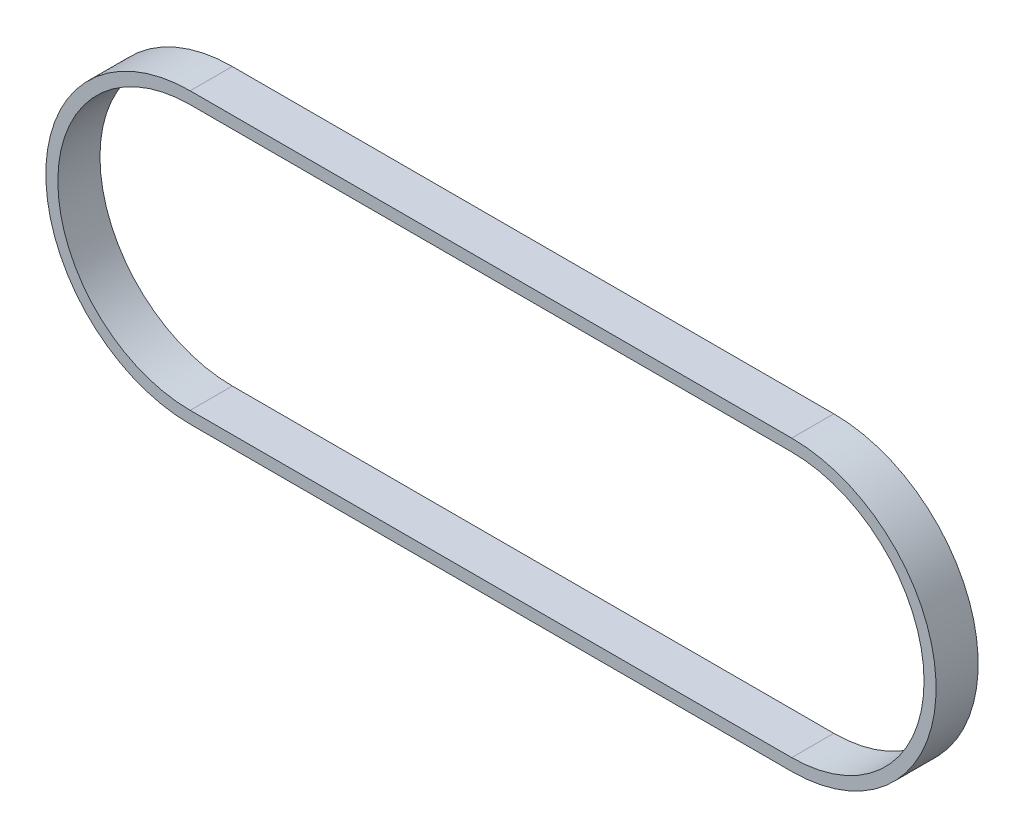
from build123d import *

# Parameters (mm, degrees)
BOSS_EXTRUDE1_DEPTH = 10.5


with BuildPart() as part:
    # Sketch1 → Boss-Extrude1 (new body)
    with BuildSketch(Plane.XY):
        with BuildLine():
            ThreePointArc((150, -36), (186, 0), (150, 36))
            Line((150, 36), (0, 36))
            ThreePointArc((0, 36), (-36, 0), (0, -36))
            Line((0, -36), (150, -36))
        make_face()
        with BuildLine():
            ThreePointArc((0, -33), (-33, 0), (0, 33))
            Line((0, 33), (150, 33))
            ThreePointArc((150, 33), (183, 0), (150, -33))
            Line((150, -33), (0, -33))
        make_face(mode=Mode.SUBTRACT)
    extrude(amount=BOSS_EXTRUDE1_DEPTH)


solid = part.part
